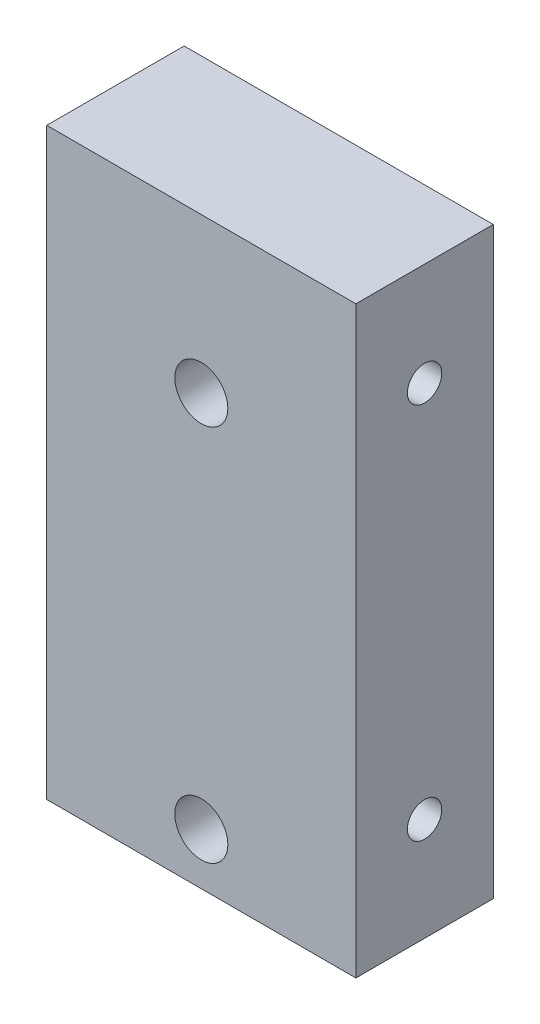
from build123d import *

# Parameters (mm, degrees)
SKETCH1_W                   = 57.15
SKETCH1_H                   = 25.4
BOSS_EXTRUDE1_DEPTH         = 53.975
F_1_4_0_25_DIAMETER_HOLE1_D = 6.35
F_3_8_CLEARANCE_HOLE1_D     = 9.8044


with BuildPart() as part:
    # Sketch1 → Boss-Extrude1 (new, symmetric)
    with BuildSketch(Plane(origin=(0, 0, 0), x_dir=(1, 0, 0), z_dir=(0, 1, 0))):
        Rectangle(SKETCH1_W, SKETCH1_H)
    extrude(amount=BOSS_EXTRUDE1_DEPTH, both=True)

    # 1/4 (0.25) Diameter Hole1 (through all)
    with Locations(Plane(origin=(28.575, 0, 0), x_dir=(0, 0, -1), z_dir=(1, 0, 0))):
        with Locations((0, -34.925), (0, 34.925)):
            Hole(F_1_4_0_25_DIAMETER_HOLE1_D / 2)

    # 3/8 Clearance Hole1 (through all)
    with Locations(Plane.XY.offset(12.7)):
        with Locations((0, -44.45), (0, 25.4)):
            Hole(F_3_8_CLEARANCE_HOLE1_D / 2)


solid = part.part
